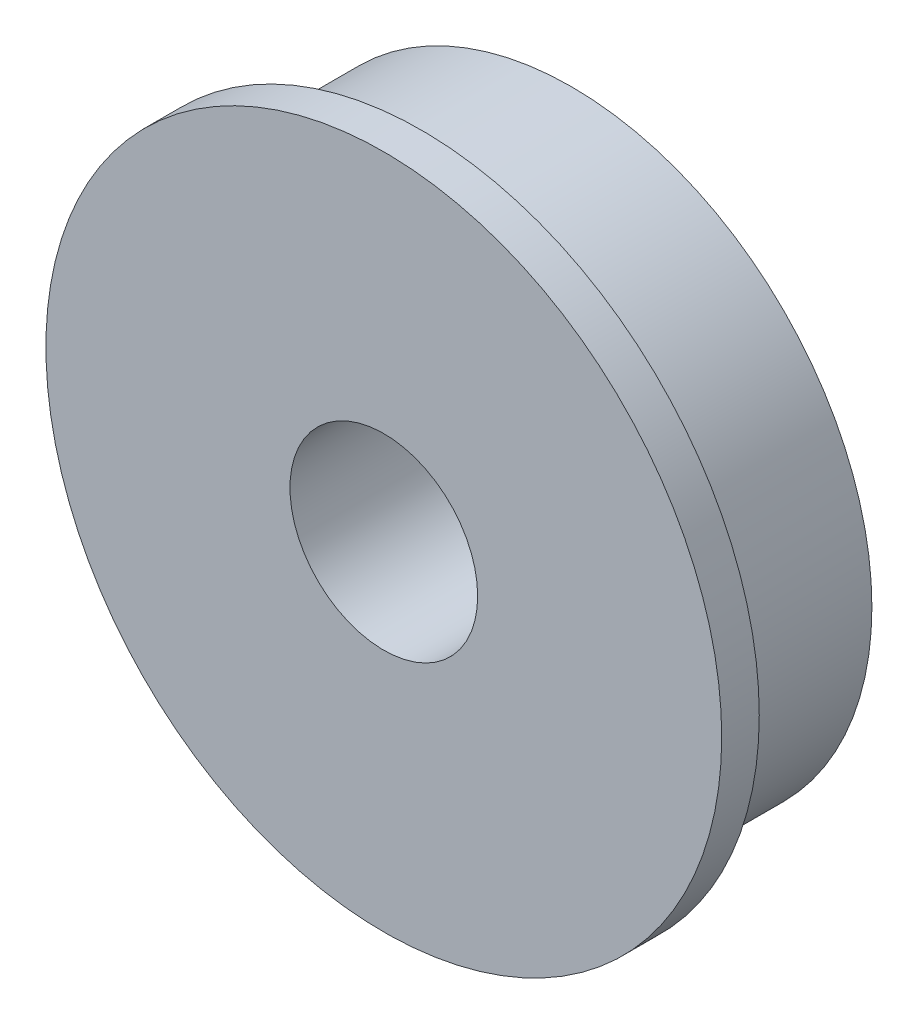
from build123d import *

# Parameters (mm, degrees)
SKETCH_1_R      = 8
SKETCH_1_R_2    = 2.5
EXTRUDE_1_DEPTH = 4
SKETCH_2_R      = 9
SKETCH_2_R_2    = 2.5
EXTRUDE_2_DEPTH = 1


with BuildPart() as part:
    # 草图1 → 凸台-拉伸1 (new body)
    with BuildSketch(Plane.XY):
        Circle(SKETCH_1_R)
        Circle(SKETCH_1_R_2, mode=Mode.SUBTRACT)
    extrude(amount=EXTRUDE_1_DEPTH)

    # 草图2 → 凸台-拉伸2 (add)
    with BuildSketch(Plane.XY.offset(4)):
        Circle(SKETCH_2_R)
        Circle(SKETCH_2_R_2, mode=Mode.SUBTRACT)
    extrude(amount=EXTRUDE_2_DEPTH)


solid = part.part
